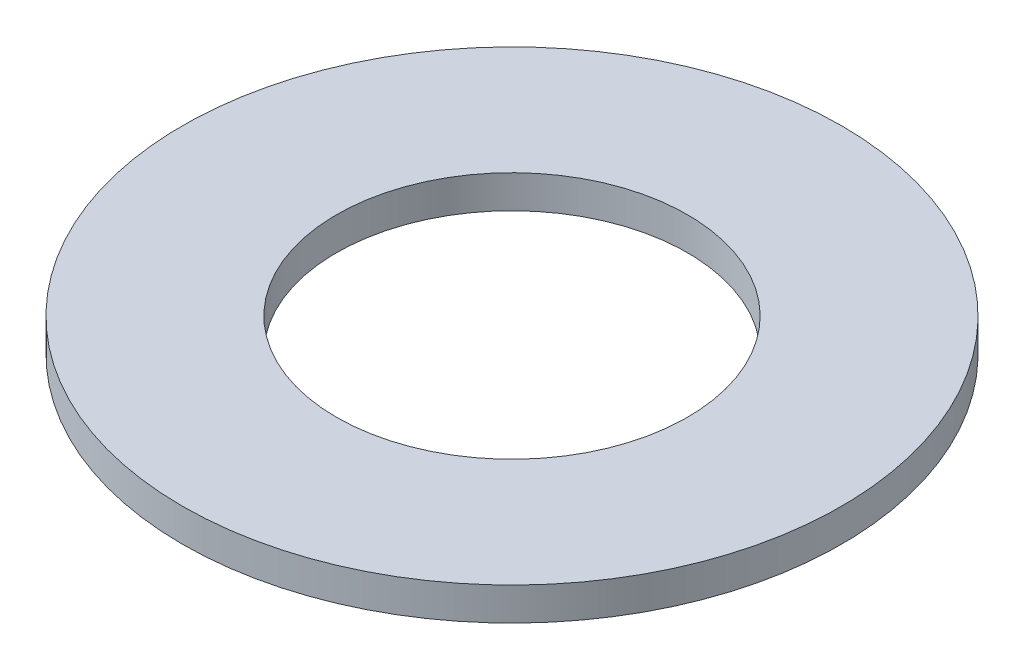
from build123d import *

# Parameters (mm, degrees)
SKETCH1_R           = 50.8
SKETCH1_R_2         = 27.051
BOSS_EXTRUDE1_DEPTH = 5.08


with BuildPart() as part:
    # Sketch1 → Boss-Extrude1 (new body)
    with BuildSketch(Plane(origin=(0, 0, 0), x_dir=(1, 0, 0), z_dir=(0, 1, 0))):
        with Locations(Location((0, 0, 0), (0, 0, 270))):
            Circle(SKETCH1_R)
        with Locations(Location((0, 0, 0), (0, 0, 270))):
            Circle(SKETCH1_R_2, mode=Mode.SUBTRACT)
    extrude(amount=BOSS_EXTRUDE1_DEPTH)


solid = part.part
